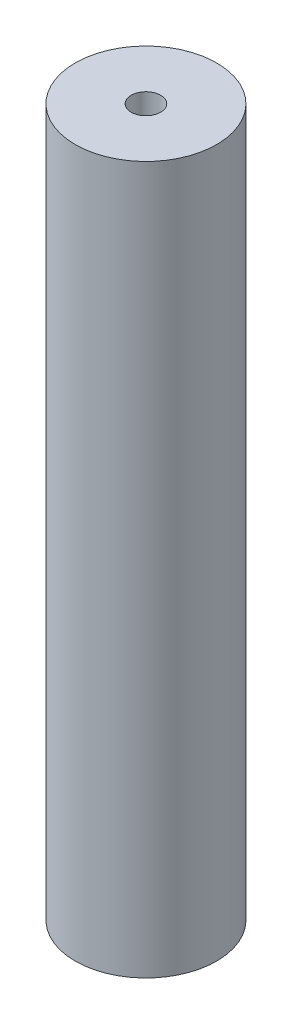
from build123d import *

# Parameters (mm, degrees)
SKETCH1_R               = 6
BOSS_EXTRUDE1_DEPTH     = 60
TAP_DRILL_FOR_M3_TAP1_D = 2.5


with BuildPart() as part:
    # Sketch1 → Boss-Extrude1 (new body)
    with BuildSketch(Plane(origin=(0, 0, 0), x_dir=(1, 0, 0), z_dir=(0, 1, 0))):
        with Locations(Location((0, 0, 0), (0, 0, 270))):
            Circle(SKETCH1_R)
    extrude(amount=BOSS_EXTRUDE1_DEPTH)

    # Tap Drill for M3 Tap1 (through all)
    with Locations(Plane(origin=(0, 60, 0), x_dir=(1, 0, 0), z_dir=(0, 1, 0))):
        with Locations((0, 0)):
            Hole(TAP_DRILL_FOR_M3_TAP1_D / 2)


solid = part.part
